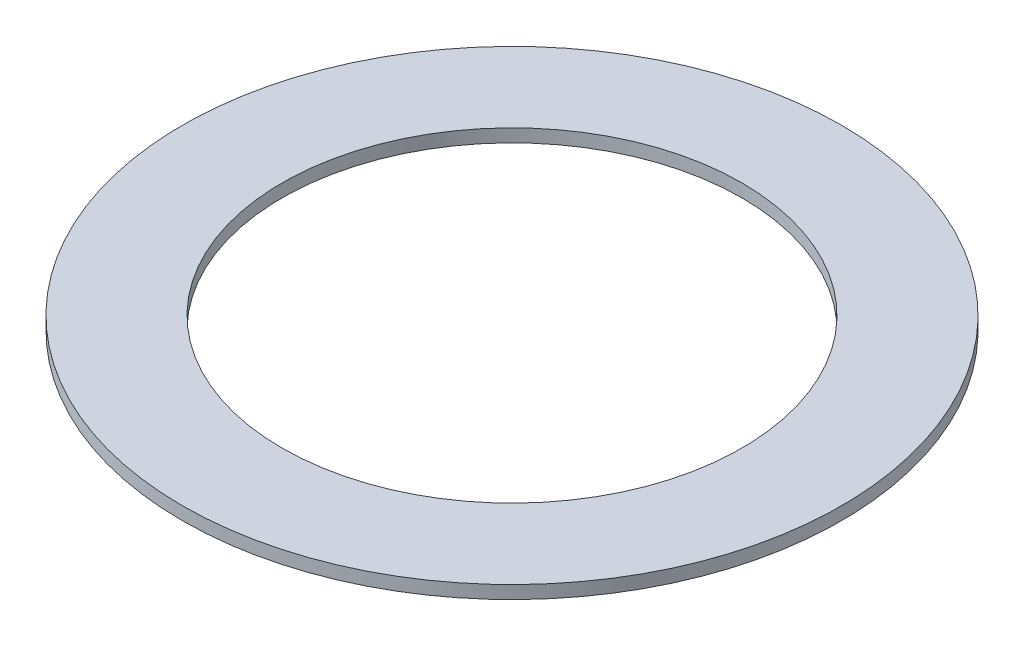
from build123d import *

# Parameters (mm, degrees)
SKETCH1_R           = 7.6
SKETCH1_R_2         = 5.3
BOSS_EXTRUDE1_DEPTH = 0.3


with BuildPart() as part:
    # Sketch1 → Boss-Extrude1 (new body)
    with BuildSketch(Plane(origin=(0, 0, 0), x_dir=(1, 0, 0), z_dir=(0, 1, 0))):
        with Locations(Location((0, 0, 0), (0, 0, 270))):
            Circle(SKETCH1_R)
        with Locations(Location((0, 0, 0), (0, 0, 270))):
            Circle(SKETCH1_R_2, mode=Mode.SUBTRACT)
    extrude(amount=BOSS_EXTRUDE1_DEPTH)


solid = part.part
